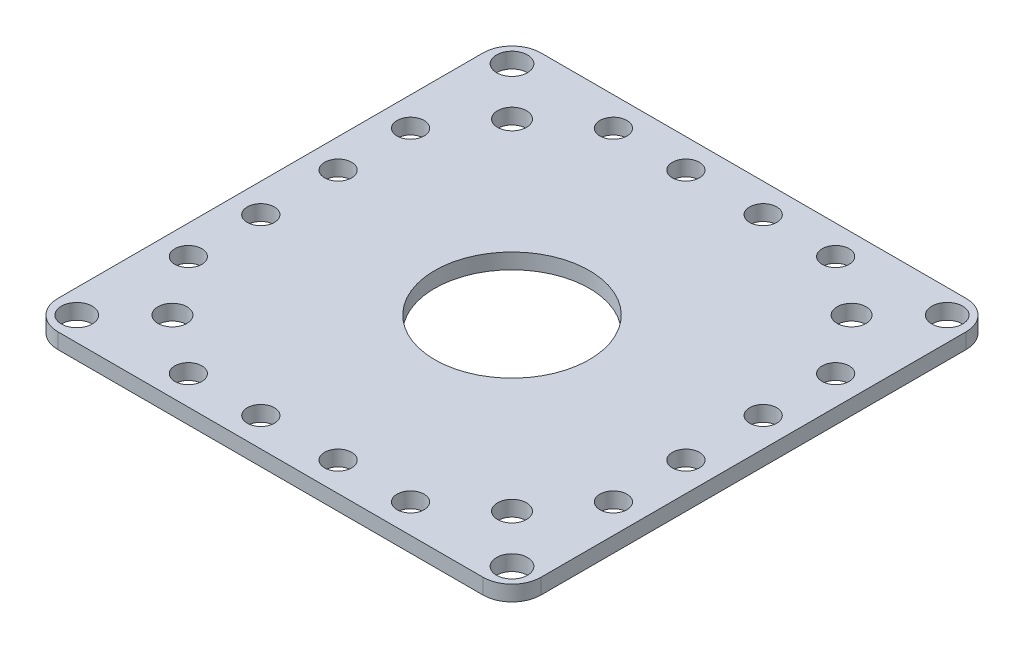
from build123d import *

# Parameters (mm, degrees)
SKETCH1_W           = 50
SKETCH1_H           = 50
SKETCH1_R           = 8
SKETCH1_R_2         = 1.6
SKETCH1_R_3         = 1.5
SKETCH1_R_4         = 1.4
BOSS_EXTRUDE1_DEPTH = 1.6
FILLET1_R           = 3


with BuildPart() as part:
    # Sketch1 → Boss-Extrude1 (new body)
    with BuildSketch(Plane(origin=(0, 0, 0), x_dir=(1, 0, 0), z_dir=(0, 1, 0))):
        Rectangle(SKETCH1_W, SKETCH1_H)
        with Locations(Location((0, 0, 0), (0, 0, 270))):
            Circle(SKETCH1_R, mode=Mode.SUBTRACT)
        with Locations(Location((-22.525126266, 22.525126266, 0), (0, 0, 270))):
            Circle(SKETCH1_R_2, mode=Mode.SUBTRACT)
        with Locations(Location((-17.575378798, 17.575378798, 0), (0, 0, 270))):
            Circle(SKETCH1_R_3, mode=Mode.SUBTRACT)
        with Locations(Location((-4, 22, 0), (0, 0, 270))):
            Circle(SKETCH1_R_4, mode=Mode.SUBTRACT)
        with Locations(Location((-11.5, 22, 0), (0, 0, 270))):
            Circle(SKETCH1_R_4, mode=Mode.SUBTRACT)
        with Locations(Location((4, 22, 0), (0, 0, 90))):
            Circle(SKETCH1_R_4, mode=Mode.SUBTRACT)
        with Locations(Location((11.5, 22, 0), (0, 0, 90))):
            Circle(SKETCH1_R_4, mode=Mode.SUBTRACT)
        with Locations(Location((22, 11.5, 0), (0, 0, 270))):
            Circle(SKETCH1_R_4, mode=Mode.SUBTRACT)
        with Locations(Location((22, 4, 0), (0, 0, 270))):
            Circle(SKETCH1_R_4, mode=Mode.SUBTRACT)
        with Locations(Location((22, -4, 0), (0, 0, 90))):
            Circle(SKETCH1_R_4, mode=Mode.SUBTRACT)
        with Locations(Location((22, -11.5, 0), (0, 0, 90))):
            Circle(SKETCH1_R_4, mode=Mode.SUBTRACT)
        with Locations(Location((11.5, -22, 0), (0, 0, 270))):
            Circle(SKETCH1_R_4, mode=Mode.SUBTRACT)
        with Locations(Location((4, -22, 0), (0, 0, 270))):
            Circle(SKETCH1_R_4, mode=Mode.SUBTRACT)
        with Locations(Location((-4, -22, 0), (0, 0, 90))):
            Circle(SKETCH1_R_4, mode=Mode.SUBTRACT)
        with Locations(Location((-11.5, -22, 0), (0, 0, 90))):
            Circle(SKETCH1_R_4, mode=Mode.SUBTRACT)
        with Locations(Location((-22, -11.5, 0), (0, 0, 270))):
            Circle(SKETCH1_R_4, mode=Mode.SUBTRACT)
        with Locations(Location((-22, -4, 0), (0, 0, 270))):
            Circle(SKETCH1_R_4, mode=Mode.SUBTRACT)
        with Locations(Location((-22, 4, 0), (0, 0, 90))):
            Circle(SKETCH1_R_4, mode=Mode.SUBTRACT)
        with Locations(Location((-22, 11.5, 0), (0, 0, 90))):
            Circle(SKETCH1_R_4, mode=Mode.SUBTRACT)
        with Locations(Location((22.525126266, 22.525126266, 0), (0, 0, 270))):
            Circle(SKETCH1_R_2, mode=Mode.SUBTRACT)
        with Locations(Location((17.575378798, 17.575378798, 0), (0, 0, 270))):
            Circle(SKETCH1_R_3, mode=Mode.SUBTRACT)
        with Locations(Location((22.525126266, -22.525126266, 0), (0, 0, 270))):
            Circle(SKETCH1_R_2, mode=Mode.SUBTRACT)
        with Locations(Location((17.575378798, -17.575378798, 0), (0, 0, 270))):
            Circle(SKETCH1_R_3, mode=Mode.SUBTRACT)
        with Locations(Location((-22.525126266, -22.525126266, 0), (0, 0, 270))):
            Circle(SKETCH1_R_2, mode=Mode.SUBTRACT)
        with Locations(Location((-17.575378798, -17.575378798, 0), (0, 0, 270))):
            Circle(SKETCH1_R_3, mode=Mode.SUBTRACT)
    extrude(amount=BOSS_EXTRUDE1_DEPTH)

    # Fillet1
    fillet1_edges = [part.edges().sort_by_distance(p)[0] for p in [
        (25, 0.8, 25),
        (-25, 0.8, 25),
        (-25, 0.8, -25),
        (25, 0.8, -25),
    ]]
    fillet(fillet1_edges, radius=FILLET1_R)


solid = part.part
